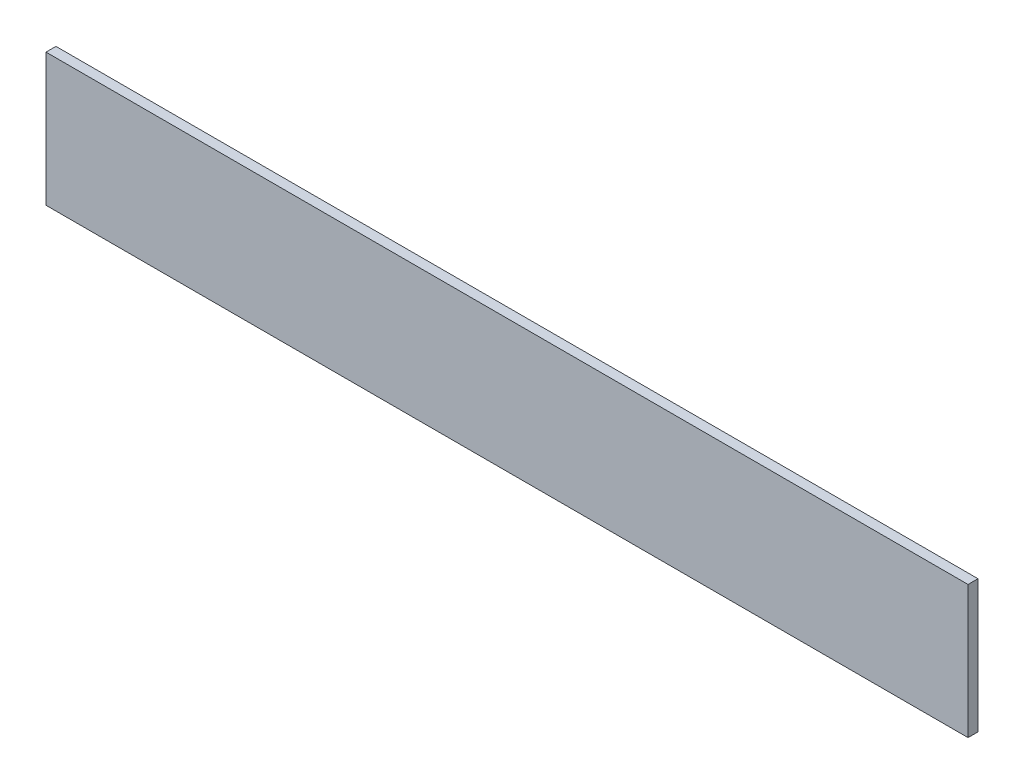
from build123d import *

# Parameters (mm, degrees)
CROQUIS1_W              = 556
CROQUIS1_H              = 80
SALIENTE_EXTRUIR1_DEPTH = 6


with BuildPart() as part:
    # Croquis1 → Saliente-Extruir1 (new body)
    with BuildSketch(Plane.XY):
        with Locations((278, 40)):
            Rectangle(CROQUIS1_W, CROQUIS1_H)
    extrude(amount=SALIENTE_EXTRUIR1_DEPTH)


solid = part.part
